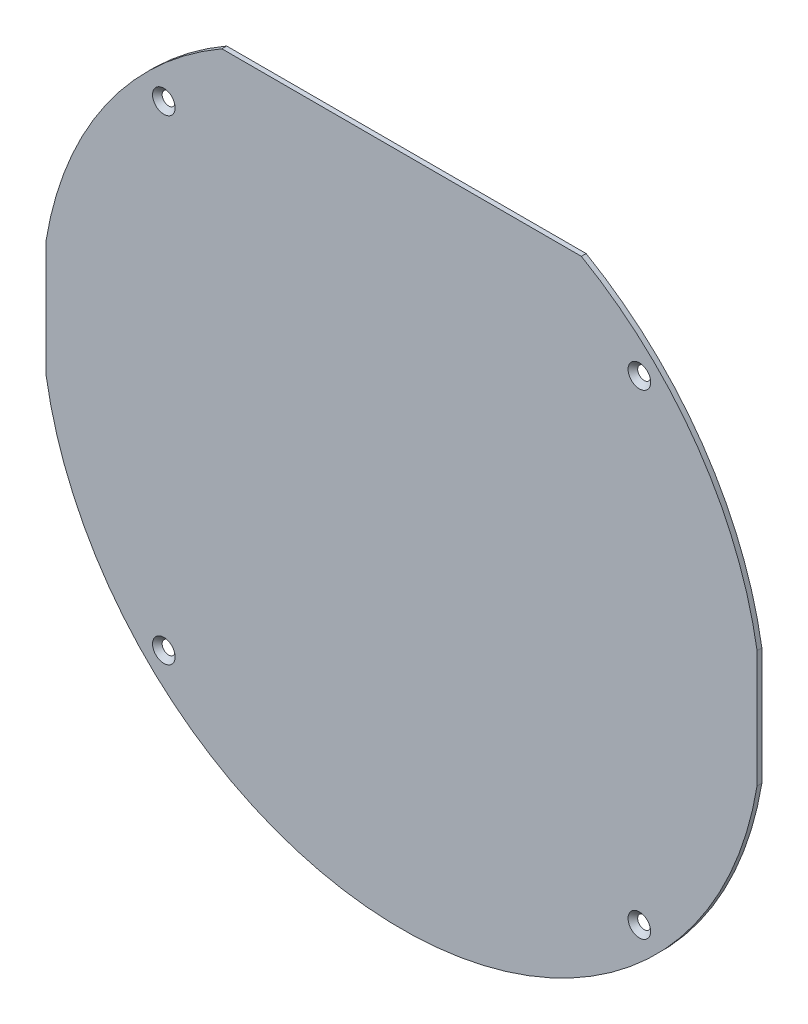
from build123d import *

# Parameters (mm, degrees)
ESQUISSE1_R                                 = 1.6
BOSS_EXTRU_1_DEPTH                          = 2
FRAISAGE_POUR_VIS_T_TE_FRAIS_E_M42_AT_COUNT = 2
FRAISAGE_POUR_VIS_T_TE_FRAIS_E_M42_AT_PITCH = 197.989898732
FRAISAGE_POUR_VIS_T_TE_FRAIS_E_M42_2_COUNT  = 2
FRAISAGE_POUR_VIS_T_TE_FRAIS_E_M42_2_PITCH  = 197.989898732
FRAISAGE_POUR_VIS_T_TE_FRAIS_E_M42_3_COUNT  = 2
FRAISAGE_POUR_VIS_T_TE_FRAIS_E_M42_3_PITCH  = 280


with BuildPart() as part:
    # Esquisse1 → Boss.-Extru.1 (new body)
    with BuildSketch(Plane.XY):
        with BuildLine():
            Line((-74.833147735, 130), (74.833147735, 130))
            ThreePointArc((74.833147735, 130), (123.291527294, 85.435351568), (148, 24.413111231))
            Line((148, 24.413111231), (148, -24.413111231))
            ThreePointArc((148, -24.413111231), (0, -150), (-148, -24.413111231))
            Line((-148, -24.413111231), (-148, 24.413111231))
            ThreePointArc((-148, 24.413111231), (-123.291527294, 85.435351568), (-74.833147735, 130))
        make_face()
        with Locations((-98.994949366, 98.994949366)):
            Circle(ESQUISSE1_R, mode=Mode.SUBTRACT)
        with Locations((-98.994949366, -98.994949366)):
            Circle(ESQUISSE1_R, mode=Mode.SUBTRACT)
        with Locations((98.994949366, -98.994949366)):
            Circle(ESQUISSE1_R, mode=Mode.SUBTRACT)
        with Locations((98.994949366, 98.994949366)):
            Circle(ESQUISSE1_R, mode=Mode.SUBTRACT)
    extrude(amount=BOSS_EXTRU_1_DEPTH)

    # Esquisse4 → Fraisage pour vis à tête fraisée M42 (revolve, cut)
    with BuildSketch(Plane(origin=(98.994949366, 98.994949366, 2), x_dir=(0, -1, 0), z_dir=(1, 0, 0))):
        Polygon((0, 0), (0, 2), (2.25, 2), (2.25, 2.45), (4.7, 0), align=None)
    fraisage_pour_vis_t_te_frais_e_m42 = revolve(axis=Axis((98.994949366, 98.994949366, 8.35), (0, 0, -1)), mode=Mode.SUBTRACT)

    # Fraisage pour vis à tête fraisée M42 at: Fraisage pour vis à tête fraisée M42 ×2
    with Locations(*[(-i * FRAISAGE_POUR_VIS_T_TE_FRAIS_E_M42_AT_PITCH, 0, 0) for i in range(1, FRAISAGE_POUR_VIS_T_TE_FRAIS_E_M42_AT_COUNT)]):
        add(fraisage_pour_vis_t_te_frais_e_m42, mode=Mode.SUBTRACT)

    # Fraisage pour vis _ t_te frais_e M42 2: Fraisage pour vis à tête fraisée M42 ×2
    with Locations(*[(0, -i * FRAISAGE_POUR_VIS_T_TE_FRAIS_E_M42_2_PITCH, 0) for i in range(1, FRAISAGE_POUR_VIS_T_TE_FRAIS_E_M42_2_COUNT)]):
        add(fraisage_pour_vis_t_te_frais_e_m42, mode=Mode.SUBTRACT)

    # Fraisage pour vis _ t_te frais_e M42 3: Fraisage pour vis à tête fraisée M42 ×2
    with Locations(*[Vector(-0.707106781186546, -0.707106781186549, 0) * (i * FRAISAGE_POUR_VIS_T_TE_FRAIS_E_M42_3_PITCH) for i in range(1, FRAISAGE_POUR_VIS_T_TE_FRAIS_E_M42_3_COUNT)]):
        add(fraisage_pour_vis_t_te_frais_e_m42, mode=Mode.SUBTRACT)


solid = part.part
